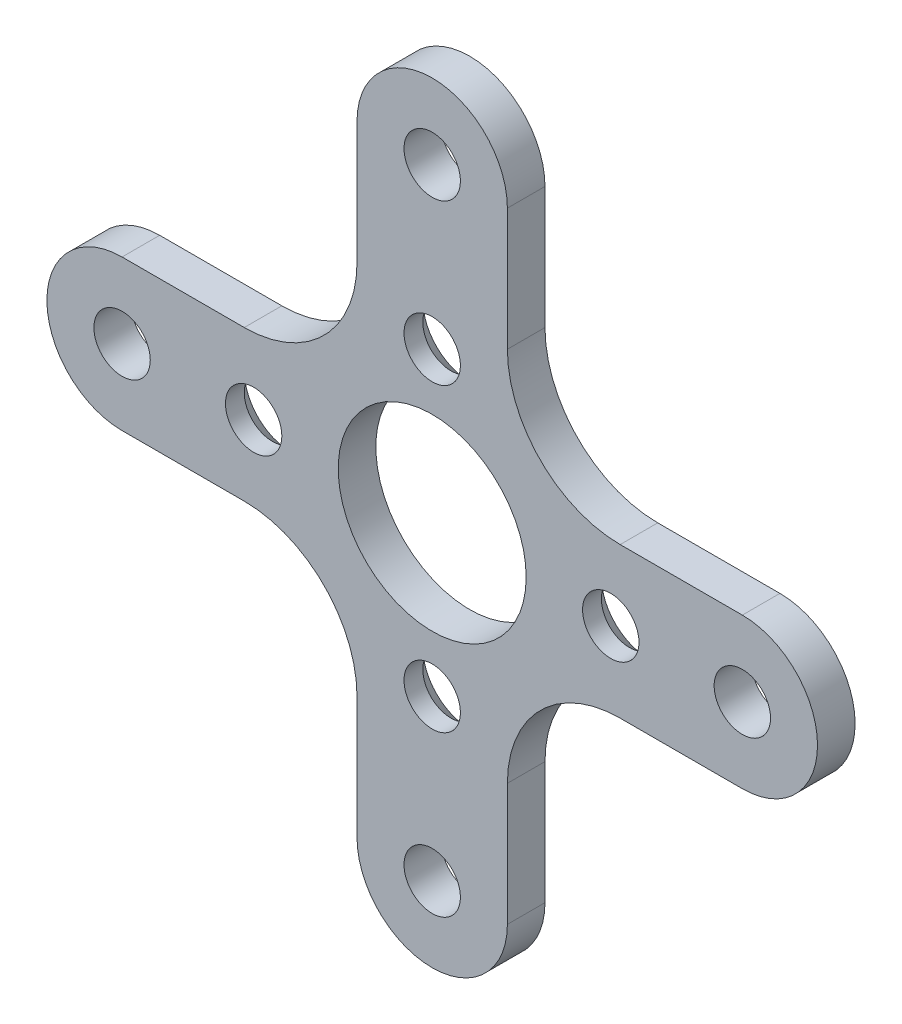
from build123d import *

# Parameters (mm, degrees)
IZIM1_R                     = 1.5
IZIM1_R_2                   = 5
Y_KSEKLIK_EKSTR_ZYON1_DEPTH = 2
CHAMFER_1_SIZE              = 1


with BuildPart() as part:
    # Çizim1 → Yükseklik-Ekstrüzyon1 (new body)
    with BuildSketch(Plane.XY):
        with BuildLine():
            Line((10, 4), (16.5, 4))
            ThreePointArc((16.5, 4), (20.500000347, 3.47e-07), (16.500000694, -4))
            Line((16.500000694, -4), (10.000000694, -4))
            ThreePointArc((10.000000694, -4), (5.757359762, -5.757359558), (4.000000694, -10.000000694))
            Line((4.000000694, -10.000000694), (4.000000694, -16.500000694))
            ThreePointArc((4.000000694, -16.500000694), (6.94e-07, -20.500000694), (-3.999999306, -16.500000694))
            Line((-3.999999306, -16.500000694), (-3.999999306, -10.000000694))
            ThreePointArc((-3.999999306, -10.000000694), (-5.757358864, -5.757359762), (-10, -4.000000694))
            Line((-10, -4.000000694), (-16.5, -4.000000694))
            ThreePointArc((-16.5, -4.000000694), (-20.5, -6.94e-07), (-16.5, 3.999999306))
            Line((-16.5, 3.999999306), (-10, 3.999999306))
            ThreePointArc((-10, 3.999999306), (-5.757359067, 5.757358864), (-4, 10))
            Line((-4, 10), (-4, 16.5))
            ThreePointArc((-4, 16.5), (0, 20.5), (4, 16.5))
            Line((4, 16.5), (4, 10))
            ThreePointArc((4, 10), (5.757359313, 5.757359313), (10, 4))
        make_face()
        with Locations((0, 8)):
            Circle(IZIM1_R, mode=Mode.SUBTRACT)
        with Locations((16.500000347, 0)):
            Circle(IZIM1_R, mode=Mode.SUBTRACT)
        with Locations((9.5, -6.94e-07)):
            Circle(IZIM1_R, mode=Mode.SUBTRACT)
        with Locations((0, 16.5)):
            Circle(IZIM1_R, mode=Mode.SUBTRACT)
        with Locations((6.94e-07, -16.500000694)):
            Circle(IZIM1_R, mode=Mode.SUBTRACT)
        with Locations((6.94e-07, -8.000000694)):
            Circle(IZIM1_R, mode=Mode.SUBTRACT)
        Circle(IZIM1_R_2, mode=Mode.SUBTRACT)
        with Locations((-16.5, -6.94e-07)):
            Circle(IZIM1_R, mode=Mode.SUBTRACT)
        with Locations((-9.5, -6.94e-07)):
            Circle(IZIM1_R, mode=Mode.SUBTRACT)
    extrude(amount=Y_KSEKLIK_EKSTR_ZYON1_DEPTH)

    # Фаска1
    chamfer_1_edges = [part.edges().sort_by_distance(p)[0] for p in [
        (-1.5, 8, 0),
        (8, -6.94e-07, 0),
        (-1.499999306, -8.000000694, 0),
        (-11, -6.94e-07, 0),
    ]]
    chamfer(chamfer_1_edges, length=CHAMFER_1_SIZE)


solid = part.part
